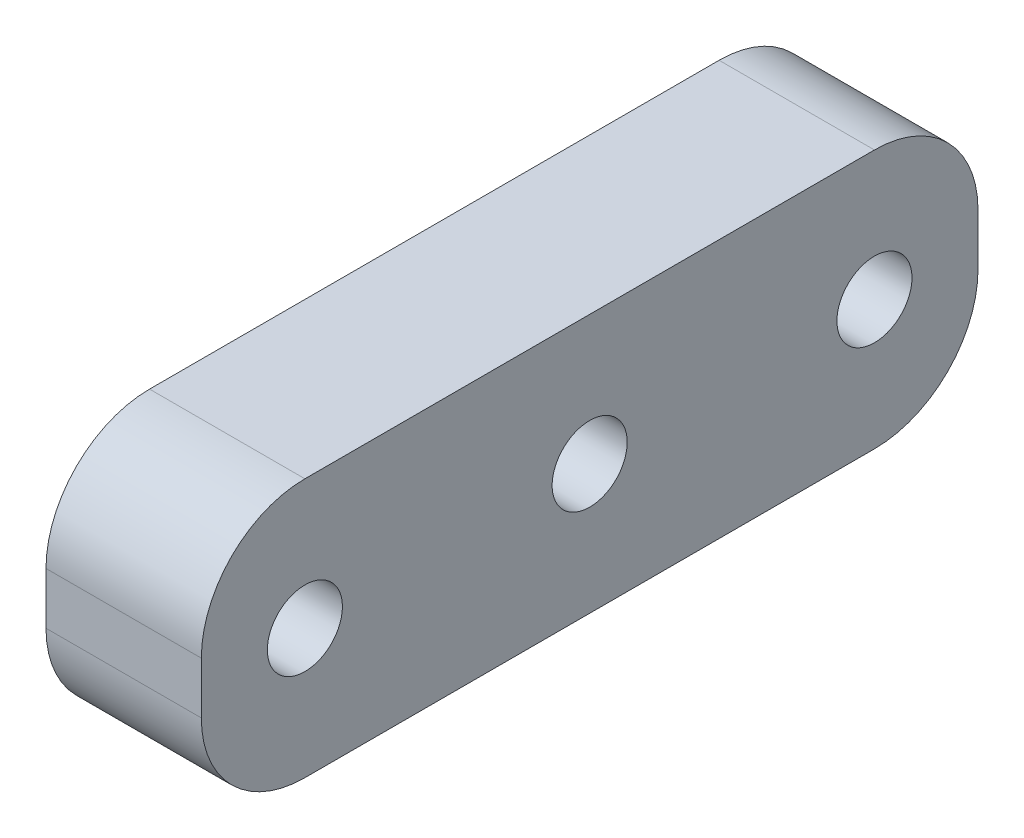
from build123d import *

# Parameters (mm, degrees)
SKETCH1_W           = 30
SKETCH1_H           = 10
BOSS_EXTRUDE1_DEPTH = 6
SKETCH2_R           = 1.45
CUT_EXTRUDE1_DEPTH  = 33.186953879
FILLET1_R           = 4


with BuildPart() as part:
    # Sketch1 → Boss-Extrude1 (new body)
    with BuildSketch(Plane(origin=(0, 0, 0), x_dir=(0, 0, -1), z_dir=(1, 0, 0))):
        with Locations((15, -5)):
            Rectangle(SKETCH1_W, SKETCH1_H)
    extrude(amount=BOSS_EXTRUDE1_DEPTH)

    # Sketch2 → Cut-Extrude1 (cut, through all)
    with BuildSketch(Plane(origin=(6, 0, 0), x_dir=(0, 0, -1), z_dir=(1, 0, 0))):
        with Locations((4, -5)):
            Circle(SKETCH2_R)
        with Locations((15, -5)):
            Circle(SKETCH2_R)
        with Locations((26, -5)):
            Circle(SKETCH2_R)
    extrude(amount=-CUT_EXTRUDE1_DEPTH, mode=Mode.SUBTRACT)

    # Fillet1
    fillet1_edges = [part.edges().sort_by_distance(p)[0] for p in [
        (3, 0, 0),
        (3, 0, -30),
        (3, -10, -30),
        (3, -10, 0),
    ]]
    fillet(fillet1_edges, radius=FILLET1_R)


solid = part.part
